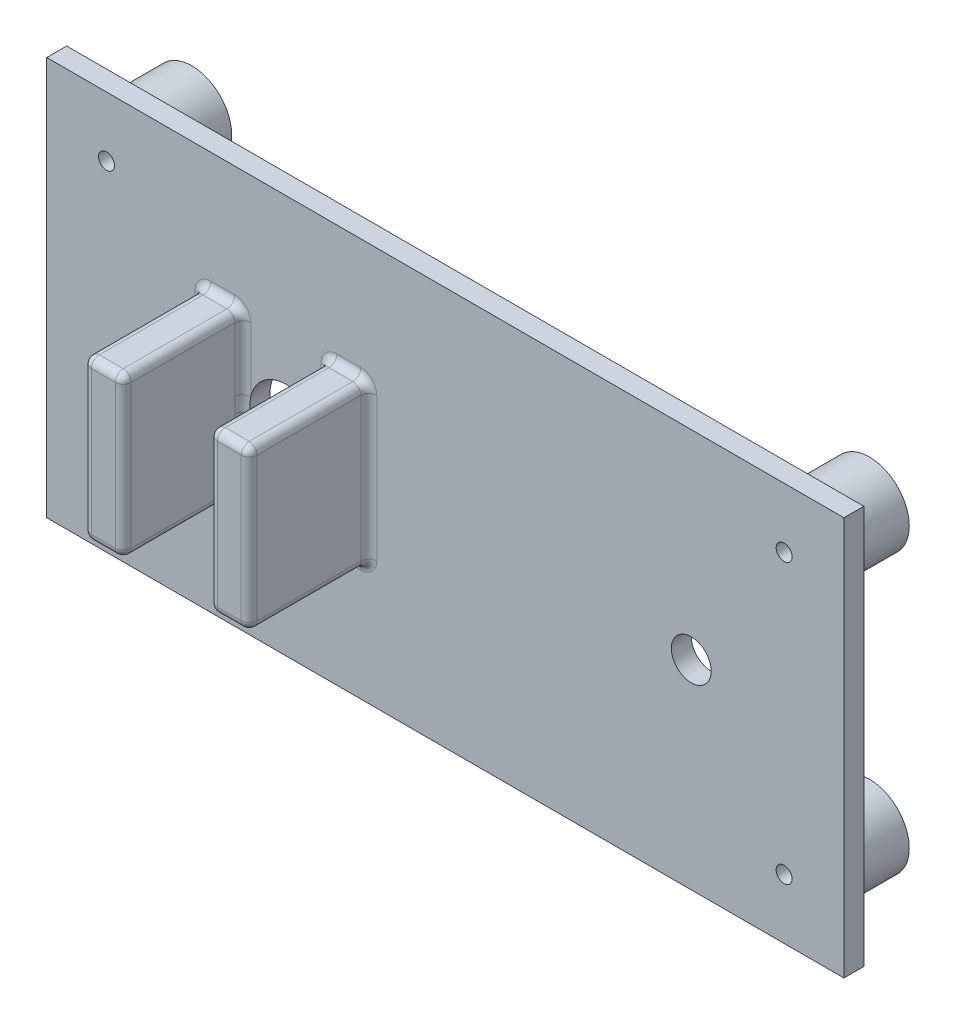
from build123d import *

# Parameters (mm, degrees)
SKETCH1_W               = 100
SKETCH1_H               = 50
BOSS_EXTRUDE1_DEPTH     = 2.5
SKETCH2_R               = 5
BOSS_EXTRUDE2_DEPTH     = 8.2
CUT_EXTRUDE1_DEPTH      = 113.314246648
CUT_EXTRUDE1_DEPTH_BACK = 113.314246648
SKETCH3_R               = 4.5
CUT_EXTRUDE4_DEPTH      = 113.314246648
CUT_EXTRUDE4_DEPTH_BACK = 113.314246648
SKETCH4_R               = 1
SKETCH6_W               = 5
SKETCH6_H               = 20
BOSS_EXTRUDE3_DEPTH     = 15
FILLET1_R               = 1
CUT_EXTRUDE5_DEPTH      = 113.805141727
CUT_EXTRUDE5_DEPTH_BACK = 113.805141727
SKETCH7_R               = 2.5


with BuildPart() as part:
    # Sketch1 → Boss-Extrude1 (new body)
    with BuildSketch(Plane.XY):
        with Locations((50, -25)):
            Rectangle(SKETCH1_W, SKETCH1_H)
    extrude(amount=BOSS_EXTRUDE1_DEPTH)

    # Sketch2 → Boss-Extrude2 (add)
    with BuildSketch(Plane(origin=(0, 0, 0), x_dir=(-1, 0, 0), z_dir=(0, 0, -1))):
        with Locations(Location((-7.5, -7.5, 0), (0, 0, 180))):
            Circle(SKETCH2_R)
        with Locations(Location((-92.5, -7.5, 0), (0, 0, 180))):
            Circle(SKETCH2_R)
        with Locations(Location((-7.5, -42.5, 0), (0, 0, 180))):
            Circle(SKETCH2_R)
        with Locations(Location((-92.5, -42.5, 0), (0, 0, 180))):
            Circle(SKETCH2_R)
    extrude(amount=BOSS_EXTRUDE2_DEPTH)

    # Sketch3 → Cut-Extrude1 (cut, two sides: drawn at the far end of the back side and taken through both)
    with BuildSketch(Plane.XY.offset(2.5).offset(-CUT_EXTRUDE1_DEPTH_BACK)):
        with Locations((30, -25)):
            Circle(SKETCH3_R)
    extrude(amount=CUT_EXTRUDE1_DEPTH + CUT_EXTRUDE1_DEPTH_BACK, mode=Mode.SUBTRACT)

    # Sketch4 → Cut-Extrude4 (cut, two sides: drawn at the far end of the back side and taken through both)
    with BuildSketch(Plane(origin=(0, 0, -8.2), x_dir=(-1, 0, 0), z_dir=(0, 0, -1)).offset(-CUT_EXTRUDE4_DEPTH_BACK)):
        with Locations((-92.5, -7.5)):
            Circle(SKETCH4_R)
        with Locations((-92.5, -42.5)):
            Circle(SKETCH4_R)
        with Locations((-7.5, -42.5)):
            Circle(SKETCH4_R)
        with Locations((-7.5, -7.5)):
            Circle(SKETCH4_R)
    extrude(amount=CUT_EXTRUDE4_DEPTH + CUT_EXTRUDE4_DEPTH_BACK, mode=Mode.SUBTRACT)

    # Sketch6 → Boss-Extrude3 (add)
    with BuildSketch(Plane.XY.offset(2.5)):
        with Locations((22.1, -25)):
            Rectangle(SKETCH6_W, SKETCH6_H)
        with Locations((37.9, -25)):
            Rectangle(SKETCH6_W, SKETCH6_H)
    extrude(amount=BOSS_EXTRUDE3_DEPTH)

    # Fillet1
    fillet1_edges = [part.edges().sort_by_distance(p)[0] for p in [
        (24.6, -25, 2.5),
        (24.6, -35, 10),
        (22.1, -15, 2.5),
        (24.6, -15, 10),
        (19.6, -25, 2.5),
        (19.6, -15, 10),
        (22.1, -35, 2.5),
        (19.6, -35, 10),
        (24.6, -25, 17.5),
        (22.1, -15, 17.5),
        (19.6, -25, 17.5),
        (22.1, -35, 17.5),
        (37.9, -15, 2.5),
        (40.4, -15, 10),
        (35.4, -25, 2.5),
        (35.4, -15, 10),
        (37.9, -35, 2.5),
        (35.4, -35, 10),
        (40.4, -25, 2.5),
        (40.4, -35, 10),
        (37.9, -15, 17.5),
        (35.4, -25, 17.5),
        (37.9, -35, 17.5),
        (40.4, -25, 17.5),
    ]]
    fillet(fillet1_edges, radius=FILLET1_R)

    # Sketch7 → Cut-Extrude5 (cut, two sides: drawn at the far end of the back side and taken through both)
    with BuildSketch(Plane.XY.offset(2.5).offset(-CUT_EXTRUDE5_DEPTH_BACK)):
        with Locations((80.857536388, -25)):
            Circle(SKETCH7_R)
    extrude(amount=CUT_EXTRUDE5_DEPTH + CUT_EXTRUDE5_DEPTH_BACK, mode=Mode.SUBTRACT)


solid = part.part
